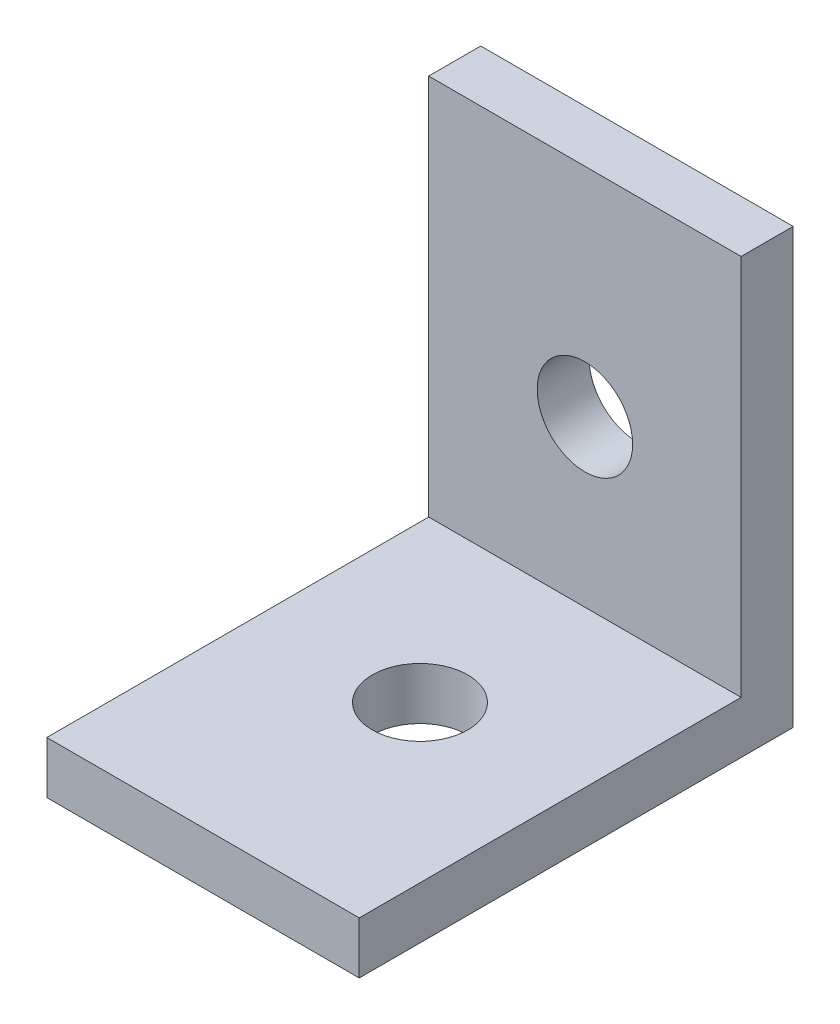
from build123d import *

# Parameters (mm, degrees)
SKETCH_1_W          = 18
SKETCH_1_H          = 25
SKETCH_1_R          = 2.75
EXTRUDE_1_DEPTH     = 3
SKETCH_2_W          = 18
SKETCH_2_H          = 3
EXTRUDE_2_DEPTH     = 22
SKETCH_3_R          = 2.75
CUT_EXTRUDE_1_DEPTH = 22


with BuildPart() as part:
    # 草图1 → 凸台-拉伸1 (new body)
    with BuildSketch(Plane(origin=(0, 0, 0), x_dir=(1, 0, 0), z_dir=(0, 1, 0))):
        Rectangle(SKETCH_1_W, SKETCH_1_H)
        with Locations(Location((0, 0, 0), (0, 0, 270))):
            Circle(SKETCH_1_R, mode=Mode.SUBTRACT)
    extrude(amount=EXTRUDE_1_DEPTH)

    # 草图2 → 凸台-拉伸2 (add)
    with BuildSketch(Plane(origin=(0, 3, 0), x_dir=(1, 0, 0), z_dir=(0, 1, 0))):
        with Locations((0, 11)):
            Rectangle(SKETCH_2_W, SKETCH_2_H)
    extrude(amount=EXTRUDE_2_DEPTH)

    # 草图3 → 切除-拉伸1 (cut)
    with BuildSketch(Plane.XY.offset(-9.5)):
        with Locations((0, 12.5)):
            Circle(SKETCH_3_R)
    extrude(amount=-CUT_EXTRUDE_1_DEPTH, mode=Mode.SUBTRACT)


solid = part.part
